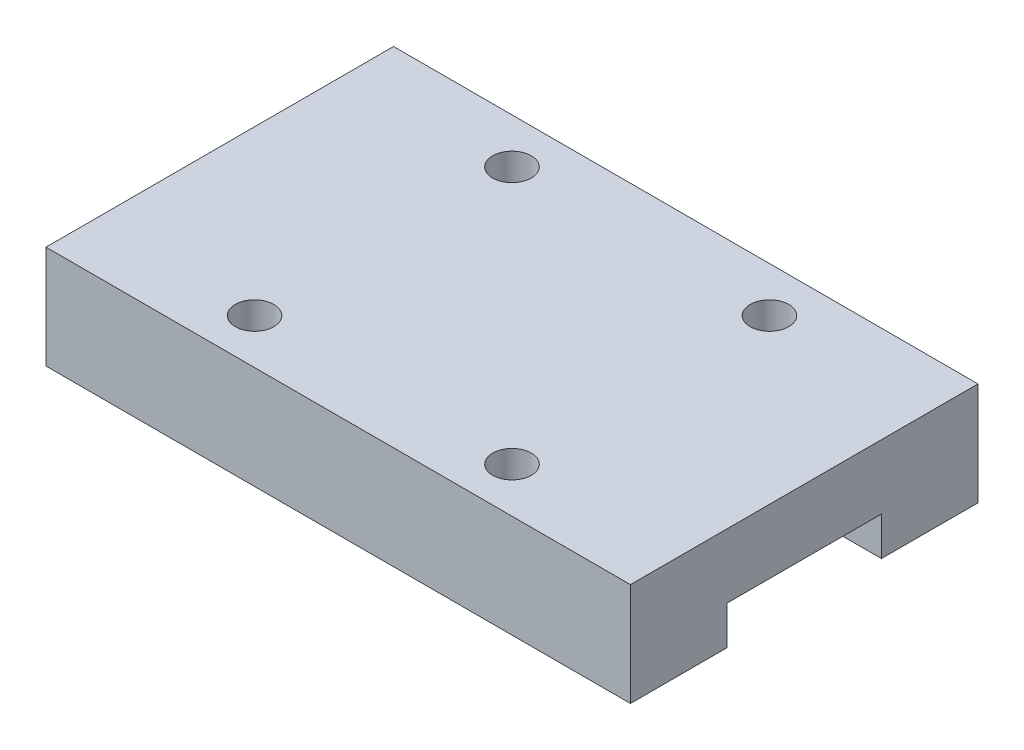
from build123d import *

# Parameters (mm, degrees)
SKETCH1_W           = 45.4
SKETCH1_H           = 27
BOSS_EXTRUDE1_DEPTH = 8
SKETCH2_W           = 12
SKETCH2_H           = 3
CUT_EXTRUDE1_DEPTH  = 49.0355077
SKETCH3_R           = 1.5
CUT_EXTRUDE2_DEPTH  = 10


with BuildPart() as part:
    # Sketch1 → Boss-Extrude1 (new body)
    with BuildSketch(Plane(origin=(0, 0, 0), x_dir=(1, 0, 0), z_dir=(0, 1, 0))):
        Rectangle(SKETCH1_W, SKETCH1_H)
    extrude(amount=BOSS_EXTRUDE1_DEPTH)

    # Sketch2 → Cut-Extrude1 (cut, through all)
    with BuildSketch(Plane(origin=(22.7, 0, 0), x_dir=(0, 0, -1), z_dir=(1, 0, 0))):
        with Locations((0, 1.5)):
            Rectangle(SKETCH2_W, SKETCH2_H)
    extrude(amount=-CUT_EXTRUDE1_DEPTH, mode=Mode.SUBTRACT)

    # Sketch3 → Cut-Extrude2 (cut)
    with BuildSketch(Plane(origin=(0, 8, 0), x_dir=(1, 0, 0), z_dir=(0, 1, 0))):
        with Locations(Location((10, -10, 0), (0, 0, 270))):
            Circle(SKETCH3_R)
        with Locations(Location((-10, -10, 0), (0, 0, 270))):
            Circle(SKETCH3_R)
        with Locations(Location((-10, 10, 0), (0, 0, 270))):
            Circle(SKETCH3_R)
        with Locations(Location((10, 10, 0), (0, 0, 270))):
            Circle(SKETCH3_R)
    extrude(amount=-CUT_EXTRUDE2_DEPTH, mode=Mode.SUBTRACT)


solid = part.part
